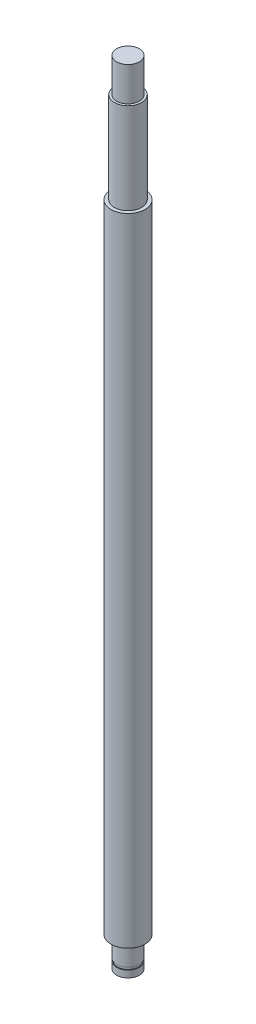
from build123d import *

# Parameters (mm, degrees)
SKETCH_1_R      = 7.5
EXTRUDE_1_DEPTH = 280
SKETCH_2_R      = 6
EXTRUDE_2_DEPTH = 40
SKETCH_3_R      = 5
EXTRUDE_3_DEPTH = 15
EXTRUDE_START   = 9
SKETCH_4_R      = 5
EXTRUDE_4_DEPTH = 9
SKETCH_5_R      = 4.65
EXTRUDE_5_DEPTH = 1.1
EXTRUDE_START_2 = 3
SKETCH_6_R      = 5
EXTRUDE_6_DEPTH = 3


with BuildPart() as part:
    # 草图1 → 凸台-拉伸1 (new body)
    with BuildSketch(Plane(origin=(0, 0, 0), x_dir=(1, 0, 0), z_dir=(0, 1, 0))):
        with Locations(Location((0, 0, 0), (0, 0, 270))):
            Circle(SKETCH_1_R)
    extrude(amount=EXTRUDE_1_DEPTH)

    # 草图2 → 凸台-拉伸2 (add)
    with BuildSketch(Plane(origin=(0, 280, 0), x_dir=(1, 0, 0), z_dir=(0, 1, 0))):
        with Locations(Location((0, 0, 0), (0, 0, 270))):
            Circle(SKETCH_2_R)
    extrude(amount=EXTRUDE_2_DEPTH)

    # 草图3 → 凸台-拉伸3 (add)
    with BuildSketch(Plane(origin=(0, 320, 0), x_dir=(1, 0, 0), z_dir=(0, 1, 0))):
        with Locations(Location((0, 0, 0), (0, 0, 270))):
            Circle(SKETCH_3_R)
    extrude(amount=EXTRUDE_3_DEPTH)

    # 草图4 → 凸台-拉伸4 (add)
    with BuildSketch(Plane.XZ.offset(EXTRUDE_START)):
        with Locations(Location((0, 0, 0), (0, 0, 90))):
            Circle(SKETCH_4_R)
    extrude(amount=-EXTRUDE_4_DEPTH)

    # 草图5 → 凸台-拉伸5 (add)
    with BuildSketch(Plane.XZ.offset(9)):
        with Locations(Location((0, 0, 0), (0, 0, 270))):
            Circle(SKETCH_5_R)
    extrude(amount=EXTRUDE_5_DEPTH)

    # 草图6 → 凸台-拉伸6 (add)
    with BuildSketch(Plane.XZ.offset(10.1).offset(EXTRUDE_START_2)):
        with Locations(Location((0, 0, 0), (0, 0, 90))):
            Circle(SKETCH_6_R)
    extrude(amount=-EXTRUDE_6_DEPTH)


solid = part.part
